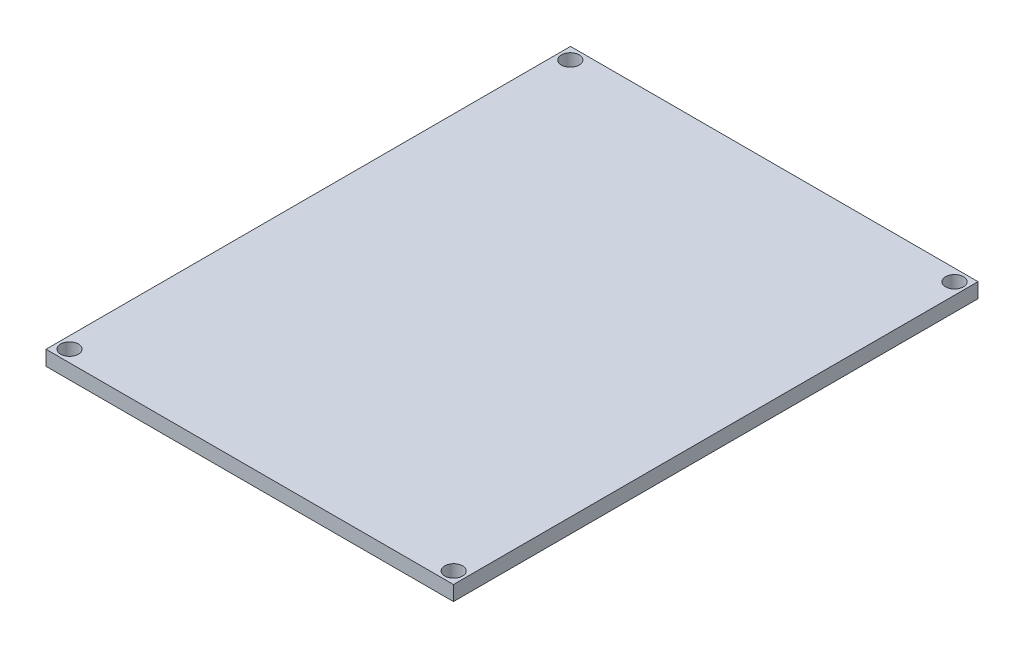
from build123d import *

# Parameters (mm, degrees)
SKETCH1_W           = 69.85
SKETCH1_H           = 89.916
BOSS_EXTRUDE1_DEPTH = 1.27
CUT_EXTRUDE1_REACH  = 58.986
SKETCH2_R           = 1.524


with BuildPart() as part:
    # Sketch1 → Boss-Extrude1 (new, symmetric)
    with BuildSketch(Plane(origin=(0, 0, 0), x_dir=(1, 0, 0), z_dir=(0, 1, 0))):
        Rectangle(SKETCH1_W, SKETCH1_H)
    extrude(amount=BOSS_EXTRUDE1_DEPTH, both=True)

    # Sketch2 → Cut-Extrude1 (cut, up to next)
    with BuildSketch(Plane(origin=(0, 1.27, 0), x_dir=(1, 0, 0), z_dir=(0, 1, 0)), mode=Mode.PRIVATE) as cut_extrude1_sk1:
        with Locations(Location((-32.9311, 42.926, 0), (0, 0, 270))):
            Circle(SKETCH2_R)
    cut_extrude1_tool1 = extrude(cut_extrude1_sk1.sketch, amount=-CUT_EXTRUDE1_REACH, mode=Mode.PRIVATE) & part.part
    # Sketch2 → Cut-Extrude1 (cut, up to next)
    with BuildSketch(Plane(origin=(0, 1.27, 0), x_dir=(1, 0, 0), z_dir=(0, 1, 0)), mode=Mode.PRIVATE) as cut_extrude1_sk2:
        with Locations(Location((32.9311, 42.926, 0), (0, 0, 270))):
            Circle(SKETCH2_R)
    cut_extrude1_tool2 = extrude(cut_extrude1_sk2.sketch, amount=-CUT_EXTRUDE1_REACH, mode=Mode.PRIVATE) & part.part
    # Sketch2 → Cut-Extrude1 (cut, up to next)
    with BuildSketch(Plane(origin=(0, 1.27, 0), x_dir=(1, 0, 0), z_dir=(0, 1, 0)), mode=Mode.PRIVATE) as cut_extrude1_sk3:
        with Locations(Location((32.9311, -42.926, 0), (0, 0, 270))):
            Circle(SKETCH2_R)
    cut_extrude1_tool3 = extrude(cut_extrude1_sk3.sketch, amount=-CUT_EXTRUDE1_REACH, mode=Mode.PRIVATE) & part.part
    # Sketch2 → Cut-Extrude1 (cut, up to next)
    with BuildSketch(Plane(origin=(0, 1.27, 0), x_dir=(1, 0, 0), z_dir=(0, 1, 0)), mode=Mode.PRIVATE) as cut_extrude1_sk4:
        with Locations(Location((-32.9311, -42.926, 0), (0, 0, 270))):
            Circle(SKETCH2_R)
    cut_extrude1_tool4 = extrude(cut_extrude1_sk4.sketch, amount=-CUT_EXTRUDE1_REACH, mode=Mode.PRIVATE) & part.part
    add(cut_extrude1_tool1.solids().sort_by_distance((-32.9311, 1.27, -42.926))[0], mode=Mode.SUBTRACT)
    add(cut_extrude1_tool2.solids().sort_by_distance((32.9311, 1.27, -42.926))[0], mode=Mode.SUBTRACT)
    add(cut_extrude1_tool3.solids().sort_by_distance((32.9311, 1.27, 42.926))[0], mode=Mode.SUBTRACT)
    add(cut_extrude1_tool4.solids().sort_by_distance((-32.9311, 1.27, 42.926))[0], mode=Mode.SUBTRACT)


solid = part.part
